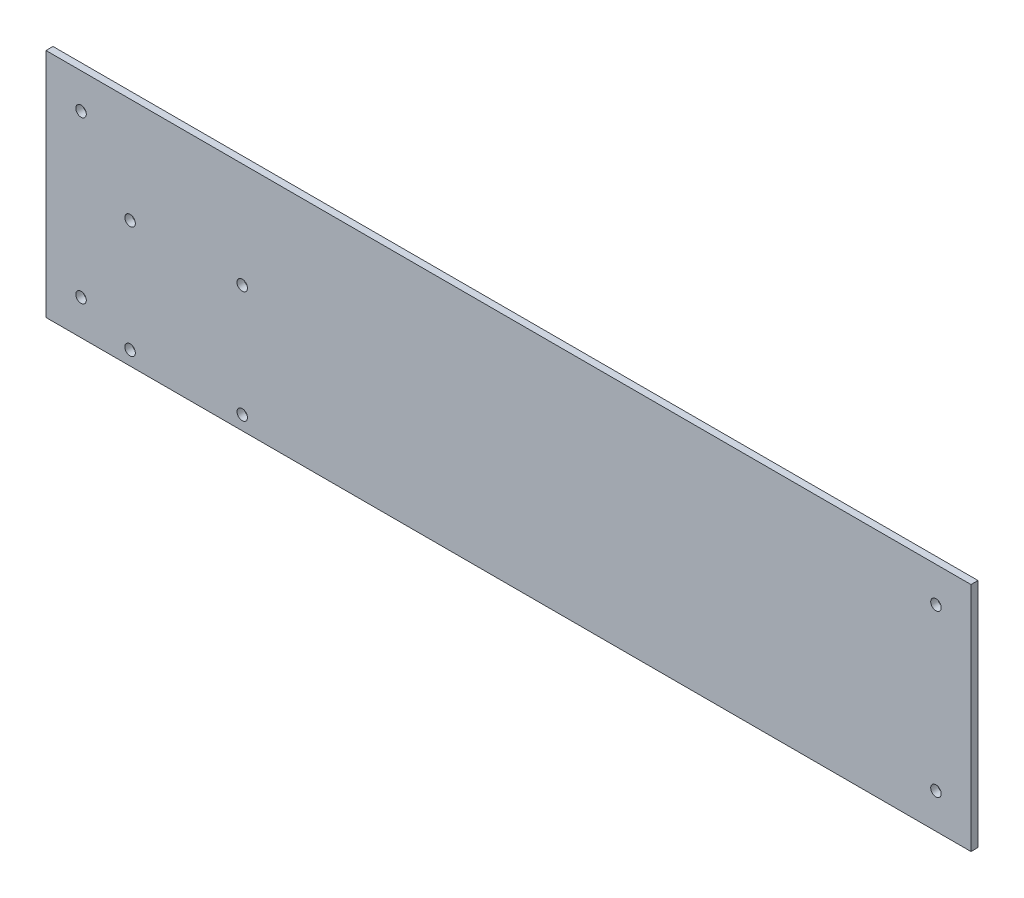
from build123d import *

# Parameters (mm, degrees)
ESQUISSE1_W      = 264
ESQUISSE1_H      = 66
ESQUISSE1_R      = 1.5
EXTRUSION1_DEPTH = 2
ESQUISSE2_R      = 1.5
EXTRUSION2_DEPTH = 10


with BuildPart() as part:
    # Esquisse1 → Extrusion1 (new body)
    with BuildSketch(Plane.XY):
        with Locations((86.261300687, 19.908191489)):
            Rectangle(ESQUISSE1_W, ESQUISSE1_H)
        with Locations((-35.738699313, 42.908191489)):
            Circle(ESQUISSE1_R, mode=Mode.SUBTRACT)
        with Locations((-35.738699313, -3.091808511)):
            Circle(ESQUISSE1_R, mode=Mode.SUBTRACT)
        with Locations((208.261300687, 42.908191489)):
            Circle(ESQUISSE1_R, mode=Mode.SUBTRACT)
        with Locations((208.261300687, -3.091808511)):
            Circle(ESQUISSE1_R, mode=Mode.SUBTRACT)
    extrude(amount=EXTRUSION1_DEPTH)

    # Esquisse2 → Extrusion2 (cut)
    with BuildSketch(Plane.XY.offset(2)):
        with Locations((-21.738699313, 22.908191489)):
            Circle(ESQUISSE2_R)
        with Locations((10.261300687, 22.908191489)):
            Circle(ESQUISSE2_R)
        with Locations((10.261300687, -9.091808511)):
            Circle(ESQUISSE2_R)
        with Locations((-21.738699313, -9.091808511)):
            Circle(ESQUISSE2_R)
    extrude(amount=-EXTRUSION2_DEPTH, mode=Mode.SUBTRACT)


solid = part.part
